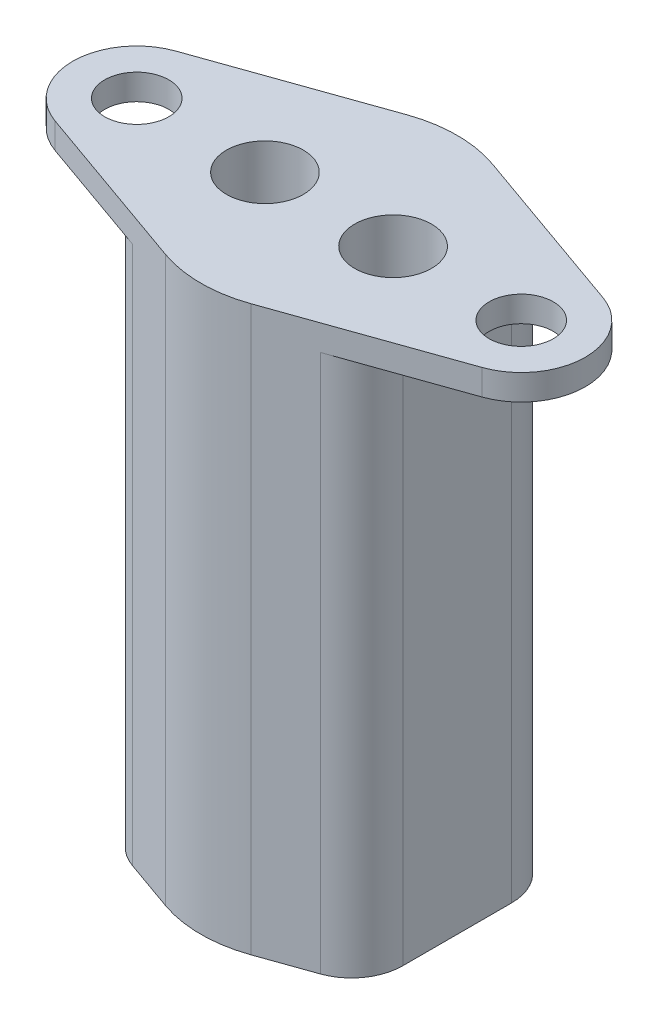
from build123d import *

# Parameters (mm, degrees)
SKETCH2_R               = 1.25
BOSS_EXTRUDE1_DEPTH     = 2
CUT_EXTRUDE1_DEPTH      = 12.357816692
CUT_EXTRUDE1_DEPTH_BACK = 12.357816692
SKETCH3_W               = 5
SKETCH3_H               = 1
FILLET1_R               = 2
BOSS_EXTRUDE2_START     = 20
BOSS_EXTRUDE2_DEPTH     = 20
SKETCH6_R               = 1.5
CUT_EXTRUDE2_DEPTH      = 25.677925359


with BuildPart() as part:
    # Sketch2 → Boss-Extrude1 (new body)
    with BuildSketch(Plane(origin=(0, 0, 0), x_dir=(1, 0, 0), z_dir=(0, 1, 0))):
        with BuildLine():
            Line((-8.333333333, -2.357022604), (-1.666666667, -4.714045208))
            ThreePointArc((-1.666666667, -4.714045208), (0, -5), (1.666666667, -4.714045208))
            Line((1.666666667, -4.714045208), (8.333333333, -2.357022604))
            ThreePointArc((8.333333333, -2.357022604), (10, 0), (8.333333333, 2.357022604))
            Line((8.333333333, 2.357022604), (1.666666667, 4.714045208))
            ThreePointArc((1.666666667, 4.714045208), (0, 5), (-1.666666667, 4.714045208))
            Line((-1.666666667, 4.714045208), (-8.333333333, 2.357022604))
            ThreePointArc((-8.333333333, 2.357022604), (-10, 0), (-8.333333333, -2.357022604))
        make_face()
        with Locations(Location((-7.5, 0, 0), (0, 0, 270))):
            Circle(SKETCH2_R, mode=Mode.SUBTRACT)
        with Locations(Location((7.5, 0, 0), (0, 0, 270))):
            Circle(SKETCH2_R, mode=Mode.SUBTRACT)
    extrude(amount=BOSS_EXTRUDE1_DEPTH)

    # Sketch3 → Cut-Extrude1 (cut, two sides: drawn at the far end of the back side and taken through both)
    with BuildSketch(Plane.XY.offset(-CUT_EXTRUDE1_DEPTH_BACK)):
        with Locations((-7.5, 0.5)):
            Rectangle(SKETCH3_W, SKETCH3_H)
        with Locations((7.5, 0.5)):
            Rectangle(SKETCH3_W, SKETCH3_H)
    extrude(amount=CUT_EXTRUDE1_DEPTH + CUT_EXTRUDE1_DEPTH_BACK, mode=Mode.SUBTRACT)

    # Fillet1
    fillet1_edges = [part.edges().sort_by_distance(p)[0] for p in [
        (-5, 0.5, -3.535533906),
        (5, 0.5, -3.535533906),
        (-5, 0.5, 3.535533906),
        (5, 0.5, 3.535533906),
    ]]
    fillet(fillet1_edges, radius=FILLET1_R)

    # Sketch5 → Boss-Extrude2 (add)
    with BuildSketch(Plane.XZ.offset(BOSS_EXTRUDE2_START)):
        with BuildLine():
            Line((5, -2.121320344), (5, 2.121320344))
            ThreePointArc((5, 2.121320344), (4.632993162, 3.276020882), (3.666666667, 4.006938427))
            Line((3.666666667, 4.006938427), (1.666666667, 4.714045208))
            ThreePointArc((1.666666667, 4.714045208), (0, 5), (-1.666666667, 4.714045208))
            Line((-1.666666667, 4.714045208), (-3.666666667, 4.006938427))
            ThreePointArc((-3.666666667, 4.006938427), (-4.632993162, 3.276020882), (-5, 2.121320344))
            Line((-5, 2.121320344), (-5, -2.121320344))
            ThreePointArc((-5, -2.121320344), (-4.632993162, -3.276020882), (-3.666666667, -4.006938427))
            Line((-3.666666667, -4.006938427), (-1.666666667, -4.714045208))
            ThreePointArc((-1.666666667, -4.714045208), (0, -5), (1.666666667, -4.714045208))
            Line((1.666666667, -4.714045208), (3.666666667, -4.006938427))
            ThreePointArc((3.666666667, -4.006938427), (4.632993162, -3.276020882), (5, -2.121320344))
        make_face()
    extrude(amount=-BOSS_EXTRUDE2_DEPTH)

    # Sketch6 → Cut-Extrude2 (cut, through all)
    with BuildSketch(Plane.XZ.offset(20)):
        with Locations(Location((-2.5, 0, 0), (0, 0, 270))):
            Circle(SKETCH6_R)
        with Locations(Location((2.5, 0, 0), (0, 0, 270))):
            Circle(SKETCH6_R)
    extrude(amount=-CUT_EXTRUDE2_DEPTH, mode=Mode.SUBTRACT)


solid = part.part
